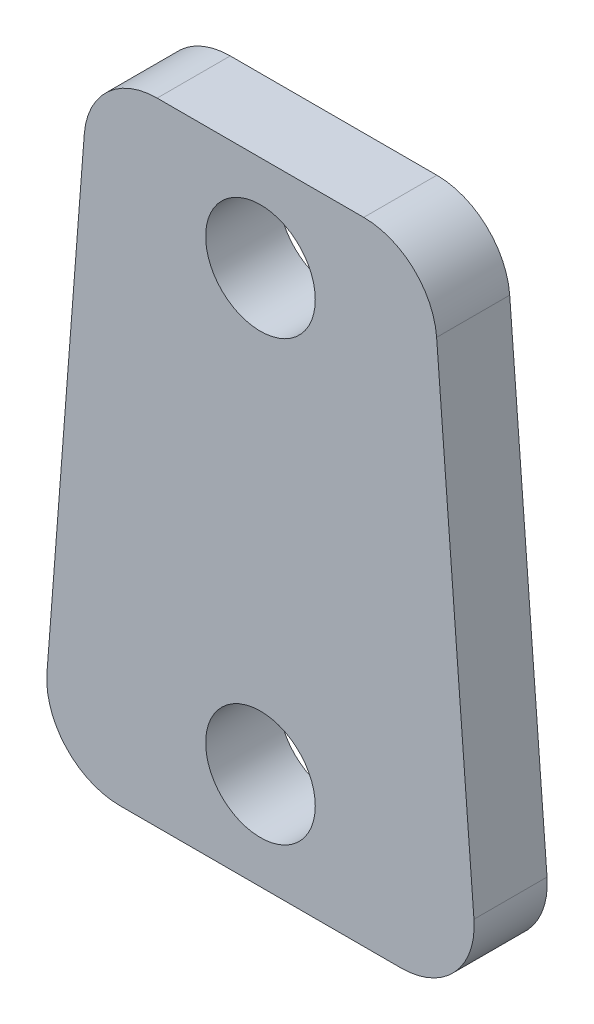
from build123d import *

# Parameters (mm, degrees)
BOSS_EXTRUDE1_DEPTH = 3.175


with BuildPart() as part:
    # Sketch1 → Boss-Extrude1 (new body)
    with BuildSketch(Plane.XY):
        with BuildLine():
            Line((0, 108.045250085), (0, 109.812666667))
            Line((0, 109.812666667), (-4.487722928, 109.812666667))
            ThreePointArc((-4.487722928, 109.812666667), (-6.644975388, 108.967234614), (-7.653370919, 106.881178051))
            Line((-7.653370919, 106.881178051), (-9.275063227, 85.799178051))
            ThreePointArc((-9.275063227, 85.799178051), (-8.438983183, 83.398414206), (-6.109415235, 82.380666667))
            Line((-6.109415235, 82.380666667), (0, 82.380666667))
            Line((0, 82.380666667), (0, 84.232750085))
            ThreePointArc((0, 84.232750085), (-2.38125, 86.614000085), (0, 88.995250085))
            Line((0, 88.995250085), (0, 103.282750085))
            ThreePointArc((0, 103.282750085), (-2.38125, 105.664000085), (0, 108.045250085))
        make_face()
        with BuildLine():
            Line((9.275063227, 85.799178051), (7.653370919, 106.881178051))
            ThreePointArc((7.653370919, 106.881178051), (6.644975388, 108.967234614), (4.487722928, 109.812666667))
            Line((4.487722928, 109.812666667), (0, 109.812666667))
            Line((0, 109.812666667), (0, 108.045250085))
            ThreePointArc((0, 108.045250085), (1.683798023, 107.347798107), (2.38125, 105.664000085))
            ThreePointArc((2.38125, 105.664000085), (1.683798023, 103.980202062), (0, 103.282750085))
            Line((0, 103.282750085), (0, 88.995250085))
            ThreePointArc((0, 88.995250085), (1.683798023, 88.297798107), (2.38125, 86.614000085))
            ThreePointArc((2.38125, 86.614000085), (1.683798023, 84.930202062), (0, 84.232750085))
            Line((0, 84.232750085), (0, 82.380666667))
            Line((0, 82.380666667), (6.109415235, 82.380666667))
            ThreePointArc((6.109415235, 82.380666667), (8.438983183, 83.398414206), (9.275063227, 85.799178051))
        make_face()
    extrude(amount=BOSS_EXTRUDE1_DEPTH)


solid = part.part
